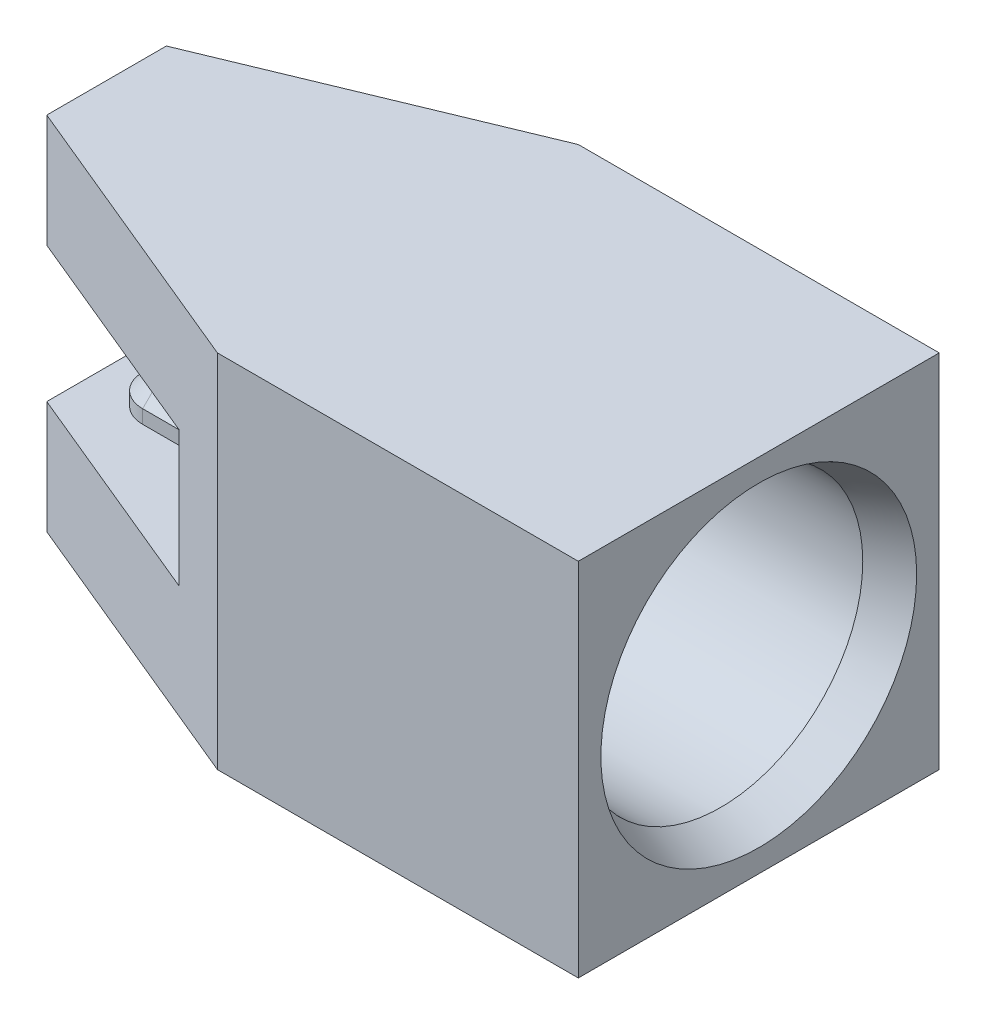
from build123d import *

# Parameters (mm, degrees)
AUFSATZ_LINEAR_AUSTRAGEN1_DEPTH            = 4
SCHNITT_LINEAR_AUSTRAGEN1_DEPTH            = 19.540887303
SCHNITT_LINEAR_AUSTRAGEN1_DEPTH_BACK       = 19.540887303
SKIZZE2_W                                  = 8.2
SKIZZE2_H                                  = 3
AUFSATZ_LINEAR_AUSTRAGEN2_DEPTH            = 0.6
FASE1_SIZE                                 = 0.3
FASE1_OF_SPIEGELN1_SIZE                    = 0.3
SCHNITT_LINEAR_AUSTRAGEN2_DEPTH            = 19.540887303
SCHNITT_LINEAR_AUSTRAGEN2_DEPTH_BACK       = 19.540887303
SKIZZE10_W                                 = 3.2
SKIZZE10_H                                 = 8
F_6_3_6_3_DURCHMESSER_BOHRUNG1_D           = 6.3
F_6_3_6_3_DURCHMESSER_BOHRUNG1_DEPTH       = 7.5
F_6_3_6_3_DURCHMESSER_BOHRUNG1_CSINK_D     = 7
F_6_3_6_3_DURCHMESSER_BOHRUNG1_CSINK_ANGLE = 45
F_6_3_6_3_DURCHMESSER_BOHRUNG1_TIP         = 1.89271095


with BuildPart() as part:
    # Skizze1 → Aufsatz-Linear austragen1 (new, symmetric)
    with BuildSketch(Plane(origin=(0, 0, 0), x_dir=(1, 0, 0), z_dir=(0, 1, 0))):
        with BuildLine():
            Line((2.956414504, 1.224586984), (9.656854249, 4))
            Line((9.656854249, 4), (17.656854249, 4))
            Line((17.656854249, 4), (17.656854249, -4))
            Line((17.656854249, -4), (9.656854249, -4))
            Line((9.656854249, -4), (2.956414504, -1.224586984))
            ThreePointArc((2.956414504, -1.224586984), (3.2, 0), (2.956414504, 1.224586984))
        make_face()
    extrude(amount=AUFSATZ_LINEAR_AUSTRAGEN1_DEPTH, both=True)

    # Skizze2 → Schnitt-Linear austragen1 (cut, two sides: drawn at the far end of the back side and taken through both)
    with BuildSketch(Plane.XY.offset(-SCHNITT_LINEAR_AUSTRAGEN1_DEPTH_BACK)):
        with Locations((4.1, 0)):
            Rectangle(SKIZZE2_W, SKIZZE2_H)
    extrude(amount=SCHNITT_LINEAR_AUSTRAGEN1_DEPTH + SCHNITT_LINEAR_AUSTRAGEN1_DEPTH_BACK, mode=Mode.SUBTRACT)

    # Skizze7 → Aufsatz-Linear austragen2 (add)
    with BuildSketch(Plane.XZ.offset(-1.5)):
        with BuildLine():
            Line((4.7, 0.7), (5.5, 0.7))
            ThreePointArc((5.5, 0.7), (6.2, 0), (5.5, -0.7))
            Line((5.5, -0.7), (4.7, -0.7))
            ThreePointArc((4.7, -0.7), (4, 0), (4.7, 0.7))
        make_face()
    aufsatz_linear_austragen2 = extrude(amount=AUFSATZ_LINEAR_AUSTRAGEN2_DEPTH)

    # Fase1
    fase1_edges = [part.edges().sort_by_distance(p)[0] for p in [
        (4, 0.9, 0),
        (5.1, 0.9, -0.7),
        (6.2, 0.9, 0),
        (5.1, 0.9, 0.7),
    ]]
    chamfer(fase1_edges, length=FASE1_SIZE)

    # Spiegeln1: Aufsatz-Linear austragen2 across plane
    add(aufsatz_linear_austragen2.mirror(Plane.ZX))

    # Fase1 of Spiegeln1
    fase1_of_spiegeln1_edges = [part.edges().sort_by_distance(p)[0] for p in [
        (4, -0.9, 0),
        (5.1, -0.9, -0.7),
        (6.2, -0.9, 0),
        (5.1, -0.9, 0.7),
    ]]
    chamfer(fase1_of_spiegeln1_edges, length=FASE1_OF_SPIEGELN1_SIZE)

    # Skizze10 → Schnitt-Linear austragen2 (cut, two sides: drawn at the far end of the back side and taken through both)
    with BuildSketch(Plane(origin=(0, 0, 0), x_dir=(1, 0, 0), z_dir=(0, 1, 0)).offset(-SCHNITT_LINEAR_AUSTRAGEN2_DEPTH_BACK)):
        with Locations((1.6, 0)):
            Rectangle(SKIZZE10_W, SKIZZE10_H)
    extrude(amount=SCHNITT_LINEAR_AUSTRAGEN2_DEPTH + SCHNITT_LINEAR_AUSTRAGEN2_DEPTH_BACK, mode=Mode.SUBTRACT)

    # Ø6.3 (6.3) Durchmesser Bohrung1
    with Locations(Plane(origin=(17.656854249, 0, 0), x_dir=(0, 0, -1), z_dir=(1, 0, 0))):
        with Locations((0, 0)):
            CounterSinkHole(F_6_3_6_3_DURCHMESSER_BOHRUNG1_D / 2, F_6_3_6_3_DURCHMESSER_BOHRUNG1_CSINK_D / 2, depth=F_6_3_6_3_DURCHMESSER_BOHRUNG1_DEPTH, counter_sink_angle=F_6_3_6_3_DURCHMESSER_BOHRUNG1_CSINK_ANGLE)
            with Locations((0, 0, -(F_6_3_6_3_DURCHMESSER_BOHRUNG1_DEPTH + F_6_3_6_3_DURCHMESSER_BOHRUNG1_TIP / 2))):  # 118° drill point
                Cone(0, F_6_3_6_3_DURCHMESSER_BOHRUNG1_D / 2, F_6_3_6_3_DURCHMESSER_BOHRUNG1_TIP, mode=Mode.SUBTRACT)


solid = part.part
